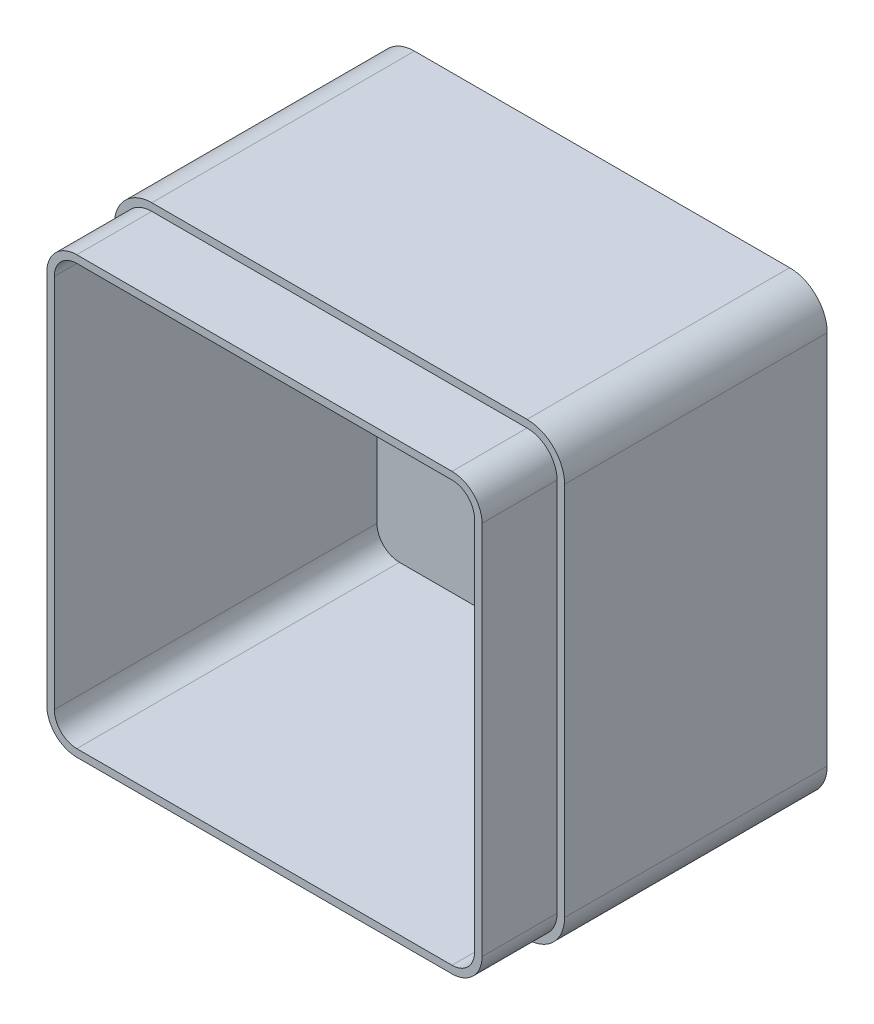
from build123d import *

# Parameters (mm, degrees)
ESQUISSE1_W             = 120
ESQUISSE1_H             = 120
BOSS_EXTRU_1_DEPTH      = 90
CONG_1_R                = 10
COQUE5_T                = -4
ENL_V_MAT_EXTRU_2_DEPTH = 20


with BuildPart() as part:
    # Esquisse1 → Boss.-Extru.1 (new body)
    with BuildSketch(Plane.XY):
        with Locations((60, 60)):
            Rectangle(ESQUISSE1_W, ESQUISSE1_H)
    extrude(amount=BOSS_EXTRU_1_DEPTH)

    # Congé1
    cong_1_edges = [part.edges().sort_by_distance(p)[0] for p in [
        (0, 120, 45),
        (0, 0, 45),
        (120, 0, 45),
        (120, 120, 45),
    ]]
    fillet(cong_1_edges, radius=CONG_1_R)

    # Coque5
    coque5_openings = [part.faces().sort_by_distance(p)[0] for p in [
        (60, 60, 90),
    ]]
    offset(amount=COQUE5_T, openings=coque5_openings, kind=Kind.INTERSECTION)

    # Esquisse11 → Enlèv. mat.-Extru.2 (cut)
    with BuildSketch(Plane.XY.offset(90)):
        with BuildLine():
            Line((10, 0), (110, 0))
            ThreePointArc((110, 0), (117.071067812, 2.928932188), (120, 10))
            Line((120, 10), (120, 110))
            ThreePointArc((120, 110), (117.071067812, 117.071067812), (110, 120))
            Line((110, 120), (10, 120))
            ThreePointArc((10, 120), (2.928932188, 117.071067812), (0, 110))
            Line((0, 110), (0, 10))
            ThreePointArc((0, 10), (2.928932188, 2.928932188), (10, 0))
        make_face()
        with BuildLine():
            Line((110, 118), (10, 118))
            ThreePointArc((10, 118), (4.343145751, 115.656854249), (2, 110))
            Line((2, 110), (2, 10))
            ThreePointArc((2, 10), (4.343145751, 4.343145751), (10, 2))
            Line((10, 2), (110, 2))
            ThreePointArc((110, 2), (115.656854249, 4.343145751), (118, 10))
            Line((118, 10), (118, 110))
            ThreePointArc((118, 110), (115.656854249, 115.656854249), (110, 118))
        make_face(mode=Mode.SUBTRACT)
    extrude(amount=-ENL_V_MAT_EXTRU_2_DEPTH, mode=Mode.SUBTRACT)


solid = part.part
